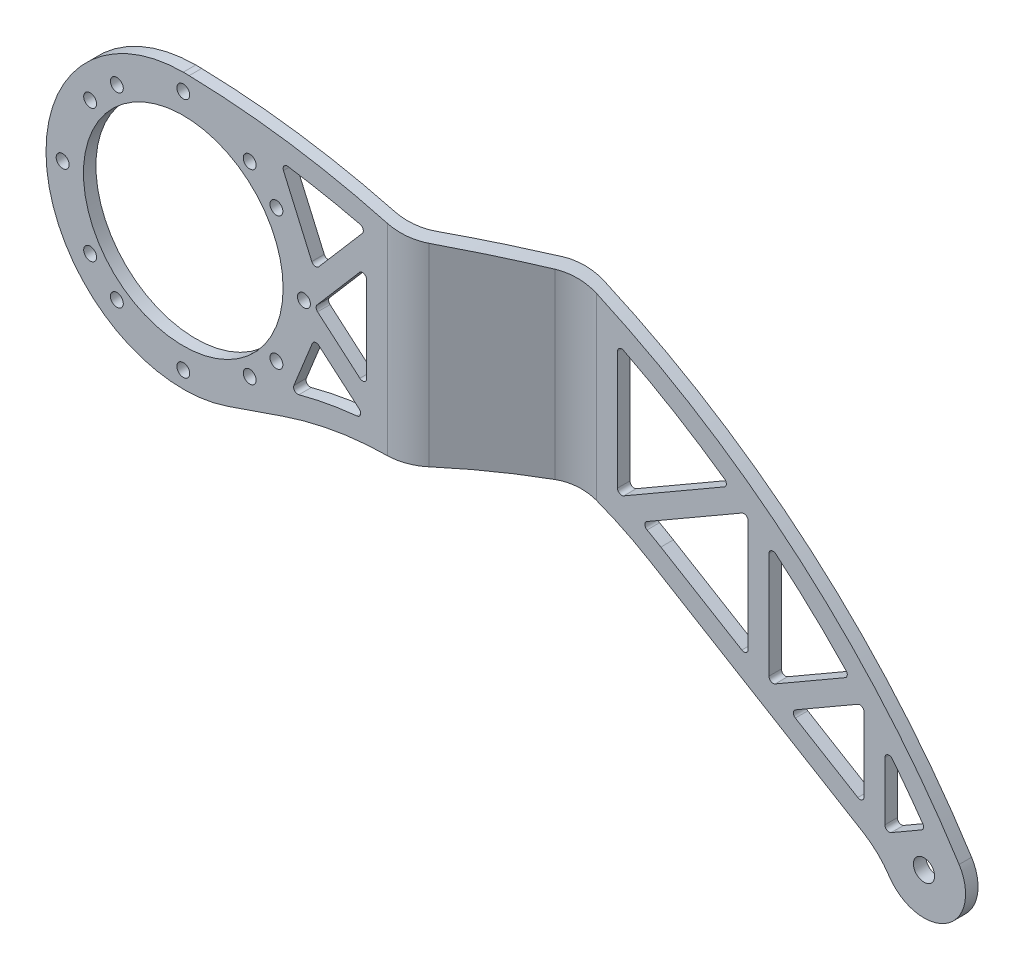
from build123d import *

# Parameters (mm, degrees)
EXTRUDE_1_DEPTH          = 3
EXTRUDE_1_DEPTH_BACK     = 21
SKETCH_1_R               = 2.55
CUT_EXTRUDE_3_DEPTH      = 185.345637541
CUT_EXTRUDE_3_DEPTH_BACK = 185.345637541
SKETCH_2_R               = 1.55
CUT_EXTRUDE_1_DEPTH      = 185.711434636
SKETCH_4_R               = 1.55
CUT_EXTRUDE_2_DEPTH      = 185.711434636
FILLET_2_R               = 10
SKETCH_10_R              = 24
CUT_EXTRUDE_5_DEPTH      = 185.711434636
CUT_EXTRUDE_6_DEPTH      = 185.345637553
CUT_EXTRUDE_7_DEPTH      = 185.711434636


with BuildPart() as part:
    # 草图1 → 凸台-拉伸1 (new, two sides: drawn at the far end of the back side and taken through both)
    with BuildSketch(Plane.XY.offset(-EXTRUDE_1_DEPTH_BACK)):
        with BuildLine():
            Line((10.730362356, -31.206719208), (23.987000348, -26.648453139))
            ThreePointArc((23.987000348, -26.648453139), (58.3964084, -22.742948884), (91.232460283, -33.745404185))
            Line((91.232460283, -33.745404185), (142.367635598, -64.500382059))
            ThreePointArc((142.367635598, -64.500382059), (145.885654628, -67.188078585), (148.726187194, -70.583891486))
            ThreePointArc((148.726187194, -70.583891486), (162.505343691, -73.443257489), (165.49953058, -59.692767585))
            ThreePointArc((165.49953058, -59.692767585), (95.05641772, 7.182197604), (1.414573065, 32.983322541))
            ThreePointArc((1.414573065, 32.983322541), (0.707335687, 32.99583049), (0, 33))
            ThreePointArc((0, 33), (-32.548592395, -5.439589421), (10.730362356, -31.206719208))
        make_face()
        with Locations((157.059520527, -65.056183502)):
            Circle(SKETCH_1_R, mode=Mode.SUBTRACT)
    extrude(amount=EXTRUDE_1_DEPTH + EXTRUDE_1_DEPTH_BACK)

    # 草图6 → 切除-拉伸3 (cut, two sides: drawn at the far end of the back side and taken through both)
    with BuildSketch(Plane(origin=(0, 0, 0), x_dir=(1, 0, 0), z_dir=(0, 1, 0)).offset(-CUT_EXTRUDE_3_DEPTH_BACK)):
        with BuildLine():
            Line((-33, 0), (47.857864376, 0))
            ThreePointArc((47.857864376, 0), (51.6846987, 0.761204675), (54.928932188, 2.928932188))
            Line((54.928932188, 2.928932188), (73, 21))
            Line((73, 21), (-33, 21))
            Line((-33, 21), (-33, 0))
        make_face()
        with BuildLine():
            Line((53.242640687, -3), (71.313708499, 15.071067812))
            ThreePointArc((71.313708499, 15.071067812), (74.557941987, 17.238795325), (78.384776311, 18))
            Line((78.384776311, 18), (167.059520527, 18))
            Line((167.059520527, 18), (167.059520527, -3))
            Line((167.059520527, -3), (53.242640687, -3))
        make_face()
    extrude(amount=CUT_EXTRUDE_3_DEPTH + CUT_EXTRUDE_3_DEPTH_BACK, mode=Mode.SUBTRACT)

    # 草图2 → 切除-拉伸1 (cut, through all)
    with BuildSketch(Plane.XY.offset(3)):
        with Locations((-29, 0)):
            Circle(SKETCH_2_R)
        with Locations((0, -29)):
            Circle(SKETCH_2_R)
        with Locations((0, 29)):
            Circle(SKETCH_2_R)
        with Locations((29, 0)):
            Circle(SKETCH_2_R)
    extrude(amount=-CUT_EXTRUDE_1_DEPTH, mode=Mode.SUBTRACT)

    # 草图4 → 切除-拉伸2 (cut, through all)
    with BuildSketch(Plane.XY.offset(3)):
        with Locations((-22.388176755, 15.969331282)):
            Circle(SKETCH_4_R)
        with Locations((15.969331282, 22.388176755)):
            Circle(SKETCH_4_R)
        with Locations((-15.969331282, -22.388176755)):
            Circle(SKETCH_4_R)
        with Locations((22.388176755, -15.969331282)):
            Circle(SKETCH_4_R)
        with Locations((-15.969331282, 22.388176755)):
            Circle(SKETCH_4_R)
        with Locations((22.388176755, 15.969331282)):
            Circle(SKETCH_4_R)
        with Locations((15.969331282, -22.388176755)):
            Circle(SKETCH_4_R)
        with Locations((-22.388176755, -15.969331282)):
            Circle(SKETCH_4_R)
    extrude(amount=-CUT_EXTRUDE_2_DEPTH, mode=Mode.SUBTRACT)

    # 圆角2
    fillet_2_edges = [part.edges().sort_by_distance(p)[0] for p in [
        (73, -3.883124825, -21),
        (53.242640687, 1.256381871, 3),
    ]]
    fillet(fillet_2_edges, radius=FILLET_2_R)

    # 草图10 → 切除-拉伸5 (cut, through all)
    with BuildSketch(Plane.XY.offset(3)):
        Circle(SKETCH_10_R)
    extrude(amount=-CUT_EXTRUDE_5_DEPTH, mode=Mode.SUBTRACT)

    # 草图12 → 切除-拉伸6 (cut, through all)
    with BuildSketch(Plane.XY.offset(-18)):
        with BuildLine():
            Line((83.384776311, 6.091687583), (83.384776311, -22.39964463))
            ThreePointArc((83.384776311, -22.39964463), (83.884776311, -23.265670034), (84.884776311, -23.265670034))
            Line((84.884776311, -23.265670034), (109.047493079, -9.315319003))
            ThreePointArc((109.047493079, -9.315319003), (109.546460743, -8.494720534), (109.124030004, -7.632222505))
            ThreePointArc((109.124030004, -7.632222505), (97.246327471, 0.117641628), (84.83676315, 6.983712189))
            ThreePointArc((84.83676315, 6.983712189), (83.861319932, 6.943740058), (83.384776311, 6.091687583))
        make_face()
        with BuildLine():
            Line((113.281262253, -12.644453923), (90.464052196, -25.817976291))
            ThreePointArc((90.464052196, -25.817976291), (89.96414418, -26.697564816), (90.487726008, -27.563270347))
            ThreePointArc((90.487726008, -27.563270347), (92.159283091, -28.493281996), (93.809489051, -29.460672836))
            Line((93.809489051, -29.460672836), (113.2658565, -41.162601043))
            ThreePointArc((113.2658565, -41.162601043), (114.27349911, -41.176116075), (114.781262253, -40.305654774))
            Line((114.781262253, -40.305654774), (114.781262253, -13.510479327))
            ThreePointArc((114.781262253, -13.510479327), (114.281262253, -12.644453923), (113.281262253, -12.644453923))
        make_face()
        with BuildLine():
            Line((119.781262253, -17.831363982), (119.781262253, -43.349206201))
            ThreePointArc((119.781262253, -43.349206201), (120.281262253, -44.215231605), (121.281262253, -44.215231605))
            Line((121.281262253, -44.215231605), (138.118809565, -34.494069132))
            ThreePointArc((138.118809565, -34.494069132), (138.608354839, -33.7722663), (138.345198637, -32.940760006))
            ThreePointArc((138.345198637, -32.940760006), (130.119442072, -24.749716604), (121.420859845, -17.062654075))
            ThreePointArc((121.420859845, -17.062654075), (120.356761129, -16.925936572), (119.781262253, -17.831363982))
        make_face()
        with BuildLine():
            Line((126.148561535, -47.178597747), (141.15550656, -38.514333997))
            ThreePointArc((141.15550656, -38.514333997), (142.15550656, -38.514333997), (142.65550656, -39.3803594))
            Line((142.65550656, -39.3803594), (142.65550656, -57.070470024))
            ThreePointArc((142.65550656, -57.070470024), (142.147743417, -57.940931325), (141.140100807, -57.927416293))
            Line((141.140100807, -57.927416293), (126.133155781, -48.90156942))
            ThreePointArc((126.133155781, -48.90156942), (125.648601507, -48.035682123), (126.148561535, -47.178597747))
        make_face()
        with BuildLine():
            Line((147.65550656, -46.357104826), (147.65550656, -60.368443488))
            ThreePointArc((147.65550656, -60.368443488), (148.15550656, -61.234468891), (149.15550656, -61.234468891))
            Line((149.15550656, -61.234468891), (156.444782946, -57.026003208))
            ThreePointArc((156.444782946, -57.026003208), (156.920756292, -56.377867749), (156.765635798, -55.588838072))
            ThreePointArc((156.765635798, -55.588838072), (153.179787293, -50.604451681), (149.438785823, -45.73543482))
            ThreePointArc((149.438785823, -45.73543482), (148.326325199, -45.41283811), (147.65550656, -46.357104826))
        make_face()
    extrude(amount=-CUT_EXTRUDE_6_DEPTH, mode=Mode.SUBTRACT)

    # 草图13 → 切除-拉伸7 (cut, through all)
    with BuildSketch(Plane.XY.offset(3)):
        with BuildLine():
            Line((24.082747749, 24.562528501), (30.890663135, 9.020360956))
            ThreePointArc((30.890663135, 9.020360956), (31.658606615, 8.432604241), (32.56499258, 8.769738674))
            Line((32.56499258, 8.769738674), (43.039867443, 20.956056938))
            ThreePointArc((43.039867443, 20.956056938), (43.233300176, 21.914677314), (42.516477142, 22.579909593))
            ThreePointArc((42.516477142, 22.579909593), (33.868822783, 24.463648028), (25.144600346, 25.953057066))
            ThreePointArc((25.144600346, 25.953057066), (24.203957809, 25.570665357), (24.082747749, 24.562528501))
        make_face()
        with BuildLine():
            Line((44.100505063, -8.734608625), (44.100505063, 11.821995662))
            ThreePointArc((44.100505063, 11.821995662), (43.448103947, 12.759638993), (42.342155031, 12.473843212))
            Line((42.342155031, 12.473843212), (32.180437397, 0.651847549))
            ThreePointArc((32.180437397, 0.651847549), (31.941627156, -0.075308628), (32.28693988, -0.758350033))
            Line((32.28693988, -0.758350033), (42.448657514, -9.492958658))
            ThreePointArc((42.448657514, -9.492958658), (43.517729494, -9.64341211), (44.100505063, -8.734608625))
        make_face()
        with BuildLine():
            Line((32.585299227, -7.608069271), (42.290408687, -15.950195656))
            ThreePointArc((42.290408687, -15.950195656), (42.592011128, -17.01009687), (41.73578717, -17.703808015))
            ThreePointArc((41.73578717, -17.703808015), (34.703564931, -18.688791633), (27.778094538, -20.257294798))
            ThreePointArc((27.778094538, -20.257294798), (26.768536314, -19.955632396), (26.589551396, -18.917281582))
            Line((26.589551396, -18.917281582), (31.006342718, -7.991627393))
            ThreePointArc((31.006342718, -7.991627393), (31.69739783, -7.394679328), (32.585299227, -7.608069271))
        make_face()
    extrude(amount=-CUT_EXTRUDE_7_DEPTH, mode=Mode.SUBTRACT)


solid = part.part
